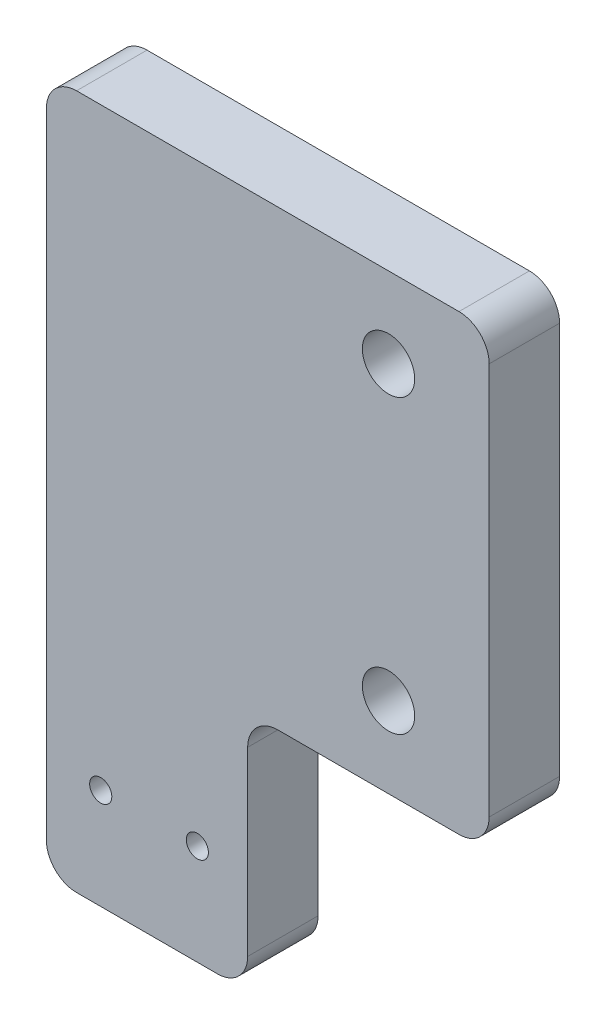
from build123d import *

# Parameters (mm, degrees)
MODEL_R             = 2.6
MODEL_R_2           = 1.1
BOSS_EXTRUDE1_DEPTH = 7


with BuildPart() as part:
    # Model → Boss-Extrude1 (new body)
    with BuildSketch(Plane.XY):
        with BuildLine():
            Line((3, 0), (41, 0))
            ThreePointArc((41, 0), (43.121320344, -0.878679656), (44, -3))
            Line((44, -3), (44, -42))
            ThreePointArc((44, -42), (43.121320344, -44.121320344), (41, -45))
            Line((41, -45), (23, -45))
            ThreePointArc((23, -45), (20.878679656, -45.878679656), (20, -48))
            Line((20, -48), (20, -66))
            ThreePointArc((20, -66), (19.121320344, -68.121320344), (17, -69))
            Line((17, -69), (3, -69))
            ThreePointArc((3, -69), (0.878679656, -68.121320344), (0, -66))
            Line((0, -66), (0, -3))
            ThreePointArc((0, -3), (0.878679656, -0.878679656), (3, 0))
        make_face()
        with Locations((34, -8)):
            Circle(MODEL_R, mode=Mode.SUBTRACT)
        with Locations((34, -37)):
            Circle(MODEL_R, mode=Mode.SUBTRACT)
        with Locations((5.4, -59)):
            Circle(MODEL_R_2, mode=Mode.SUBTRACT)
        with Locations((15, -59)):
            Circle(MODEL_R_2, mode=Mode.SUBTRACT)
    extrude(amount=BOSS_EXTRUDE1_DEPTH)


solid = part.part
